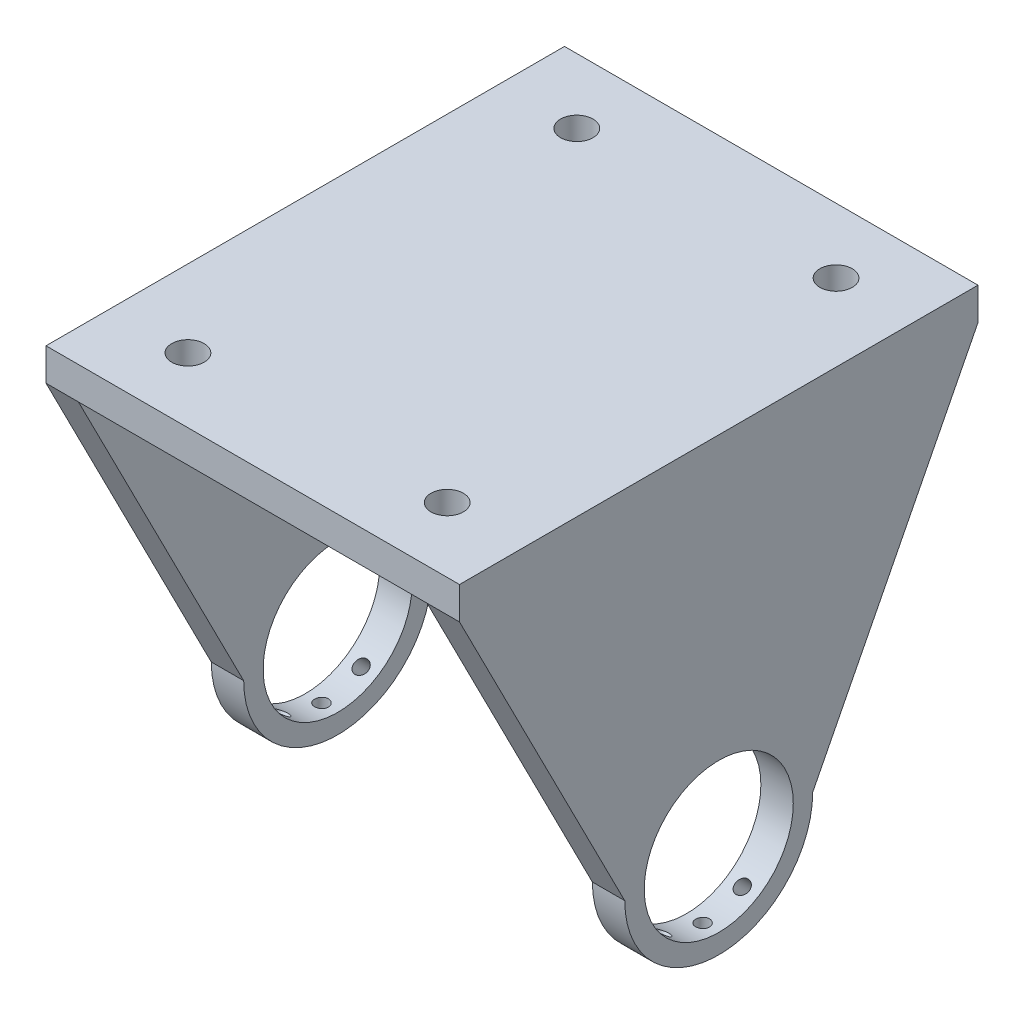
from build123d import *

# Parameters (mm, degrees)
SKETCH2_W               = 81.026
SKETCH2_H               = 101.6
BOSS_EXTRUDE1_DEPTH     = 6.35
SKETCH3_R               = 14.605
BOSS_EXTRUDE2_DEPTH     = 6.35
SKETCH5_R               = 1.35255
CUT_EXTRUDE1_DEPTH      = 16.256
SKETCH6_R               = 1.35255
CUT_EXTRUDE2_DEPTH      = 9.652
MIRROR2_COPY_1_SKETCH_R = 1.35255
MIRROR2_COPY_1_DEPTH    = 9.652
SKETCH7_R               = 3.175
CUT_EXTRUDE3_DEPTH      = 6.35


with BuildPart() as part:
    # Sketch2 → Boss-Extrude1 (new body)
    with BuildSketch(Plane(origin=(0, 0, 0), x_dir=(1, 0, 0), z_dir=(0, 1, 0))):
        Rectangle(SKETCH2_W, SKETCH2_H)
    extrude(amount=BOSS_EXTRUDE1_DEPTH)

    # Sketch3 → Boss-Extrude2 (add)
    with BuildSketch(Plane(origin=(40.513, 0, 0), x_dir=(0, 0, -1), z_dir=(1, 0, 0))):
        with BuildLine():
            Line((-50.8, 6.35), (-50.8, 0))
            Line((-50.8, 0), (-18.415, -63.5))
            ThreePointArc((-18.415, -63.5), (0, -81.915), (18.415, -63.5))
            Line((18.415, -63.5), (50.8, 0))
            Line((50.8, 0), (50.8, 6.35))
            Line((50.8, 6.35), (-50.8, 6.35))
        make_face()
        with Locations((0, -63.5)):
            Circle(SKETCH3_R, mode=Mode.SUBTRACT)
    boss_extrude2 = extrude(amount=-BOSS_EXTRUDE2_DEPTH)

    # Sketch5 → Cut-Extrude1 (cut)
    with BuildSketch(Plane(origin=(0, -81.915, 0), x_dir=(-1, 0, 0), z_dir=(0, -1, 0))):
        with Locations(Location((-37.338, 0, 0), (0, 0, 90))):
            Circle(SKETCH5_R)
    cut_extrude1 = extrude(amount=-CUT_EXTRUDE1_DEPTH, mode=Mode.SUBTRACT)

    # Sketch6 → Cut-Extrude2 (cut)
    with BuildSketch(Plane(origin=(0, -45.669396988, -45.669396988), x_dir=(1, 0, 0), z_dir=(0, 0.7071067811865464, 0.7071067811865488))):
        with Locations(Location((37.339349705, -48.118027143, 0), (0, 0, 90))):
            Circle(SKETCH6_R)
    cut_extrude2 = extrude(amount=CUT_EXTRUDE2_DEPTH, mode=Mode.SUBTRACT)

    # Mirror1: Cut-Extrude2 across plane
    add(cut_extrude2.mirror(Plane.XY), mode=Mode.SUBTRACT)

    # Mirror2: Boss-Extrude2, Cut-Extrude1, Cut-Extrude2 across plane
    add(boss_extrude2.mirror(Plane(origin=(0, 0, 0), x_dir=(0, 0, 1), z_dir=(1, 0, 0))))
    add(cut_extrude1.mirror(Plane(origin=(0, 0, 0), x_dir=(0, 0, 1), z_dir=(1, 0, 0))), mode=Mode.SUBTRACT)
    add(cut_extrude2.mirror(Plane(origin=(0, 0, 0), x_dir=(0, 0, 1), z_dir=(1, 0, 0))), mode=Mode.SUBTRACT)

    # Mirror2 copy 1 sketch → Mirror2 copy 1 (cut)
    with BuildSketch(Plane(origin=(0, -45.669396988, 45.669396988), x_dir=(-1, 0, 0), z_dir=(0, 0.7071067811865464, -0.7071067811865488))):
        with Locations(Location((37.339349705, -48.118027143, 0), (0, 0, 90))):
            Circle(MIRROR2_COPY_1_SKETCH_R)
    extrude(amount=MIRROR2_COPY_1_DEPTH, mode=Mode.SUBTRACT)

    # Sketch7 → Cut-Extrude3 (cut)
    with BuildSketch(Plane.XZ):
        with Locations(Location((-25.4, 38.1, 0), (0, 0, 270))):
            Circle(SKETCH7_R)
        with Locations(Location((25.4, 38.1, 0), (0, 0, 270))):
            Circle(SKETCH7_R)
        with Locations(Location((25.4, -38.1, 0), (0, 0, 270))):
            Circle(SKETCH7_R)
        with Locations(Location((-25.4, -38.1, 0), (0, 0, 270))):
            Circle(SKETCH7_R)
    extrude(amount=-CUT_EXTRUDE3_DEPTH, mode=Mode.SUBTRACT)


solid = part.part
